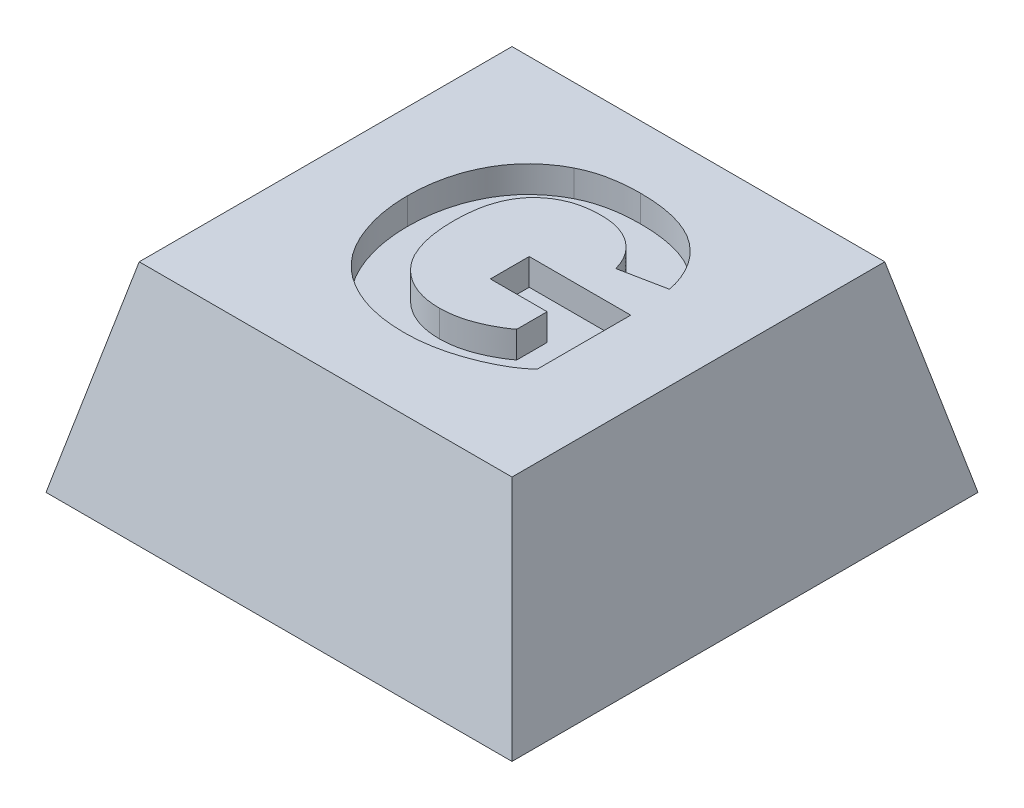
from build123d import *

# Parameters (mm, degrees)
SKETCH1_W           = 7
SKETCH1_H           = 7
BOSS_EXTRUDE1_DEPTH = 3
CUT_EXTRUDE1_DEPTH  = 7
CUT_EXTRUDE2_DEPTH  = 11
SKETCH4_R           = 1.8
CUT_EXTRUDE3_DEPTH  = 0.8
CUT_EXTRUDE4_DEPTH  = 0.4


with BuildPart() as part:
    # Sketch1 → Boss-Extrude1 (new body)
    with BuildSketch(Plane(origin=(0, 0, 0), x_dir=(1, 0, 0), z_dir=(0, 1, 0))):
        with Locations((3.5, 3.5)):
            Rectangle(SKETCH1_W, SKETCH1_H)
    extrude(amount=BOSS_EXTRUDE1_DEPTH)

    # Sketch2 → Cut-Extrude1 (cut)
    with BuildSketch(Plane.XY):
        Polygon((0, 0), (0.7, 3), (0, 3), align=None)
        Polygon((7, 0), (6.3, 3), (7, 3), align=None)
    extrude(amount=-CUT_EXTRUDE1_DEPTH, mode=Mode.SUBTRACT)

    # Sketch3 → Cut-Extrude2 (cut)
    with BuildSketch(Plane(origin=(0, 0, 0), x_dir=(0, 0, -1), z_dir=(1, 0, 0))):
        Polygon((0, 0), (0.7, 3), (0, 3), align=None)
        Polygon((7, 3), (6.3, 3), (7, 0), align=None)
    extrude(amount=CUT_EXTRUDE2_DEPTH, mode=Mode.SUBTRACT)

    # Sketch4 → Cut-Extrude3 (cut)
    with BuildSketch(Plane.XZ):
        with Locations(Location((3.5, -3.5, 0), (0, 0, 270))):
            Circle(SKETCH4_R)
    extrude(amount=-CUT_EXTRUDE3_DEPTH, mode=Mode.SUBTRACT)

    # Sketch5 → Cut-Extrude4 (cut)
    with BuildSketch(Plane(origin=(0, 3, 0), x_dir=(1, 0, 0), z_dir=(0, 1, 0))):
        with BuildLine():
            Line((3.560577146, 3.114540144), (3.560577146, 3.697873477))
            Line((3.560577146, 3.697873477), (5.086218172, 3.697873477))
            Line((5.086218172, 3.697873477), (5.086218172, 2.291423157))
            add(Edge.make_bspline(
                [(5.086218172, 2.291423157), (5.067017117, 2.274133072), (5.027766277, 2.238788642), (4.963724103, 2.188944154), (4.893219701, 2.141357686), (4.816679286, 2.095065493), (4.733944457, 2.050440158), (4.645345204, 2.006860163), (4.550718059, 1.964751709), (4.416901441, 1.91200226), (4.244652022, 1.854606501), (4.034073664, 1.804699023), (3.821829494, 1.774088797), (3.679866665, 1.770285893), (3.60895455, 1.768386298)],
                knots=[0, 0, 0, 0, 0.581799769, 1.189316438, 1.825828404, 2.496525428, 3.203088405, 3.942228803, 4.719818701, 5.534979611, 7.181138583, 8.803804008, 10.403462225, 12, 12, 12, 12], degree=3))
            add(Edge.make_bspline(
                [(3.60895455, 1.768386298), (3.564530426, 1.769053863), (3.476957263, 1.770369833), (3.347679322, 1.780962016), (3.222873793, 1.79908519), (3.10243897, 1.824748474), (2.985967191, 1.855684985), (2.87394395, 1.895149291), (2.766766964, 1.94252304), (2.663465207, 1.995311299), (2.565964473, 2.055942911), (2.474170574, 2.122268485), (2.388747899, 2.194864928), (2.310002684, 2.273878576), (2.236880415, 2.358765244), (2.170234263, 2.449929726), (2.110467262, 2.547477268), (2.056841671, 2.650184243), (2.009134136, 2.757147371), (1.968877334, 2.867524799), (1.933584129, 2.979713967), (1.904576972, 3.094108746), (1.883272633, 3.211081052), (1.866711077, 3.330089662), (1.857815915, 3.451878149), (1.85624329, 3.533798405), (1.855448941, 3.575177163)],
                knots=[0, 0, 0, 0, 1.124918047, 2.217548049, 3.282233239, 4.316494221, 5.334437038, 6.332151046, 7.320712088, 8.300141923, 9.267552434, 10.225301062, 11.165776911, 12.103230934, 13.047553934, 14.000517593, 14.959782875, 15.941944936, 16.932894943, 17.923491392, 18.915624898, 19.910402922, 20.909870877, 21.92519501, 22.95199481, 24, 24, 24, 24], degree=3))
            add(Edge.make_bspline(
                [(1.855448941, 3.575177163), (1.856093148, 3.619838006), (1.857363158, 3.70788383), (1.868308868, 3.838014535), (1.885306261, 3.964331927), (1.911081696, 4.086606684), (1.942440107, 4.205407986), (1.980711267, 4.320657597), (2.027601885, 4.431501631), (2.079763432, 4.538888047), (2.139142377, 4.641331803), (2.206237244, 4.73751889), (2.279062516, 4.828419459), (2.359057277, 4.912589631), (2.445939825, 4.989988393), (2.538826953, 5.06147172), (2.637496219, 5.128271897), (2.70811648, 5.165936981), (2.743770255, 5.184952804)],
                knots=[0, 0, 0, 0, 1.105010302, 2.178452875, 3.229459892, 4.257086284, 5.268538906, 6.268935615, 7.259234261, 8.24469117, 9.221745683, 10.185929258, 11.144249683, 12.101504986, 13.055838221, 14.020611351, 15.000673771, 16, 16, 16, 16], degree=3))
            add(Edge.make_bspline(
                [(2.743770255, 5.184952804), (2.772065201, 5.199002298), (2.829534559, 5.227537973), (2.920968547, 5.261607564), (3.016595835, 5.292607583), (3.117860188, 5.315737399), (3.224073939, 5.33474033), (3.335190018, 5.348921508), (3.4515659, 5.356368591), (3.530653011, 5.357533973), (3.571093973, 5.358129887)],
                knots=[0, 0, 0, 0, 0.887969848, 1.803539625, 2.741143579, 3.713741423, 4.722068772, 5.775476617, 6.8624965, 8, 8, 8, 8], degree=3))
            add(Edge.make_bspline(
                [(3.571093973, 5.358129887), (3.623235223, 5.357353239), (3.724640313, 5.3558428), (3.872481342, 5.343256962), (4.011619071, 5.321565683), (4.142247257, 5.29169089), (4.264084488, 5.253279835), (4.376921023, 5.206058081), (4.481449427, 5.150975954), (4.576155731, 5.085825914), (4.662964716, 5.013990372), (4.741649855, 4.935381948), (4.81224282, 4.849884207), (4.874790314, 4.75792735), (4.928800044, 4.659131282), (4.975238097, 4.554397044), (5.013462237, 4.442929528), (5.031935116, 4.365517314), (5.041346377, 4.326078605)],
                knots=[0, 0, 0, 0, 1.271135529, 2.472123572, 3.614091059, 4.701890498, 5.736279567, 6.724681829, 7.680621489, 8.611506429, 9.52200816, 10.424540711, 11.318996785, 12.221421405, 13.131851814, 14.060431888, 15.011860567, 16, 16, 16, 16], degree=3))
            Line((5.041346377, 4.326078605), (4.368269454, 4.191463221))
            add(Edge.make_bspline(
                [(4.368269454, 4.191463221), (4.361604715, 4.213549965), (4.348455309, 4.257126698), (4.322964325, 4.319678226), (4.293604309, 4.3784808), (4.260304833, 4.433960038), (4.222730432, 4.485774386), (4.179973312, 4.533364921), (4.134723148, 4.57890244), (4.084024684, 4.619217322), (4.029984173, 4.655561005), (3.973210536, 4.688333605), (3.91242093, 4.71491127), (3.848466862, 4.736295893), (3.781660913, 4.75445708), (3.71113124, 4.76562628), (3.637669879, 4.774050015), (3.58747979, 4.774545043), (3.56197939, 4.774796554)],
                knots=[0, 0, 0, 0, 1.027736275, 2.027704492, 3.005900071, 3.954421694, 4.908588141, 5.853155543, 6.803277083, 7.766271258, 8.734041521, 9.704274878, 10.683578894, 11.68490234, 12.708089448, 13.76461009, 14.864251086, 16, 16, 16, 16], degree=3))
            add(Edge.make_bspline(
                [(3.56197939, 4.774796554), (3.523383641, 4.773766807), (3.448060748, 4.771757168), (3.338099362, 4.758643838), (3.234360883, 4.735314023), (3.13657404, 4.70313499), (3.044559561, 4.661830949), (2.959560848, 4.609861345), (2.879461483, 4.550301297), (2.806540814, 4.480398046), (2.740410053, 4.402016529), (2.68316205, 4.31422182), (2.635503332, 4.217297709), (2.596468126, 4.11173088), (2.565387773, 3.997516933), (2.544303255, 3.874251546), (2.530527014, 3.742123824), (2.529206604, 3.650935474), (2.528525864, 3.603923157)],
                knots=[0, 0, 0, 0, 1.043810997, 2.037086103, 2.989314757, 3.91471467, 4.817033861, 5.710208705, 6.603920097, 7.511448416, 8.435617211, 9.371747005, 10.338444094, 11.350425613, 12.411431869, 13.5347293, 14.729025275, 16, 16, 16, 16], degree=3))
            add(Edge.make_bspline(
                [(2.528525864, 3.603923157), (2.529235737, 3.553411684), (2.530615417, 3.455239689), (2.544030551, 3.312994813), (2.566098564, 3.1804679), (2.597751337, 3.057826113), (2.637580383, 2.944634337), (2.685456676, 2.840530978), (2.744541809, 2.747447788), (2.811096159, 2.66351894), (2.885483615, 2.590182439), (2.965618207, 2.526245677), (3.051053791, 2.472061589), (3.142578213, 2.428485457), (3.239037142, 2.393797733), (3.341317359, 2.36947923), (3.449114318, 2.354373472), (3.522899335, 2.352616709), (3.560577146, 2.351719631)],
                knots=[0, 0, 0, 0, 1.318042826, 2.561693173, 3.724929596, 4.821196409, 5.862977565, 6.853497791, 7.804600806, 8.73339865, 9.643480846, 10.524649628, 11.404635349, 12.277659519, 13.165160235, 14.075017549, 15.017020959, 16, 16, 16, 16], degree=3))
            add(Edge.make_bspline(
                [(3.560577146, 2.351719631), (3.598739169, 2.352780416), (3.675428288, 2.354912133), (3.790294349, 2.372976278), (3.905609834, 2.399558249), (4.018668414, 2.439657646), (4.128467307, 2.485651373), (4.2309763, 2.53865833), (4.326972813, 2.593911136), (4.384773897, 2.636975114), (4.413141249, 2.658109855)],
                knots=[0, 0, 0, 0, 0.993821502, 1.997150276, 3.023717651, 4.073291794, 5.118404464, 6.123376694, 7.078999408, 8, 8, 8, 8], degree=3))
            Line((4.413141249, 2.658109855), (4.413141249, 3.114540144))
            Line((4.413141249, 3.114540144), (3.560577146, 3.114540144))
        make_face()
    extrude(amount=-CUT_EXTRUDE4_DEPTH, mode=Mode.SUBTRACT)


solid = part.part
